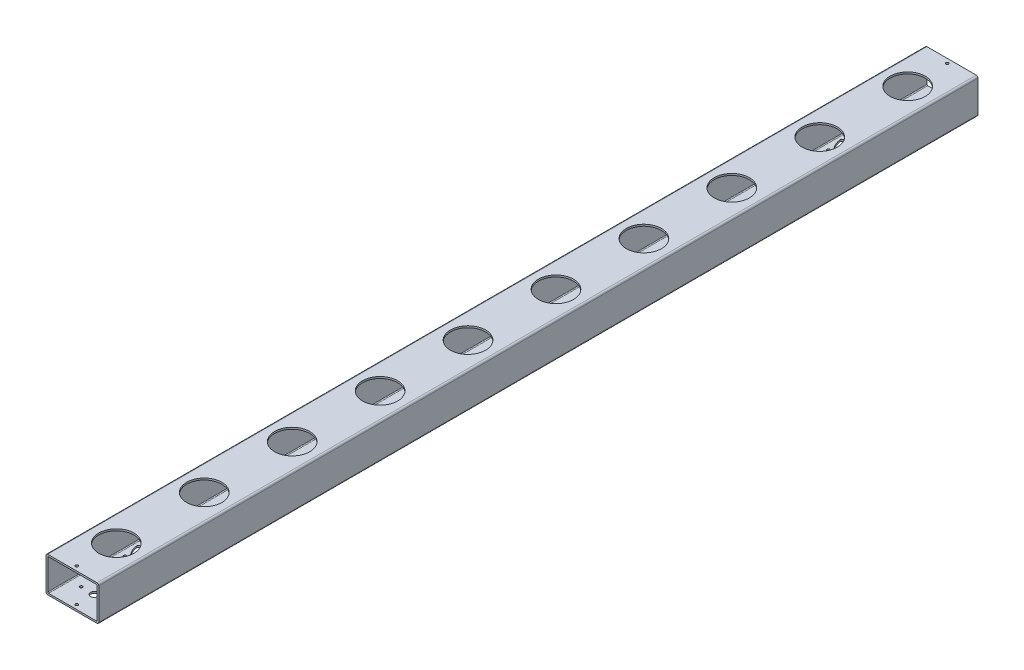
from build123d import *

# Parameters (mm, degrees)
ESQUISSE1_W                      = 60
ESQUISSE1_H                      = 40
ESQUISSE1_W_2                    = 56
ESQUISSE1_H_2                    = 36
BOSS_EXTRU_1_DEPTH               = 1000
CONG_1_R                         = 1
CONG_2_R                         = 2
ENL_V_MAT_EXTRU_1_REACH          = 1004.597
ESQUISSE2_R                      = 20
ENL_V_MAT_EXTRU_2_REACH          = 1004.597
ESQUISSE3_R                      = 4.25
ENL_V_MAT_EXTRU_4_REACH          = 1004.597
ESQUISSE6_R                      = 2.25
R_P_TITION_LIN_AIRE1_COUNT       = 3
R_P_TITION_LIN_AIRE1_PITCH       = 200
R_P_TITION_LIN_AIRE1_COL_COUNT   = 2
R_P_TITION_LIN_AIRE1_COL_PITCH   = 200
ENL_V_MAT_EXTRU_5_REACH          = 1004.597
ESQUISSE7_R                      = 1.6
ENL_V_MAT_EXTRU_6_REACH          = 1004.597
ESQUISSE9_R                      = 1.1
R_P_TITION_LIN_AIRE3_COUNT       = 10
R_P_TITION_LIN_AIRE3_PITCH       = 100
ENL_V_MAT_EXTRU_7_REACH          = 1004.597
ESQUISSE10_R                     = 1.75
R_P_TITION_LIN_AIRE4_COUNT       = 2
R_P_TITION_LIN_AIRE4_PITCH       = 800
ENL_V_MAT_EXTRU_8_REACH          = 1004.597
CONG_3_R                         = 2
R_P_TITION_LIN_AIRE5_COUNT       = 2
R_P_TITION_LIN_AIRE5_PITCH       = 800
CONG_3_OF_R_P_TITION_LIN_AIRE5_R = 2
ENL_V_MAT_EXTRU_9_REACH          = 1004.597
ESQUISSE12_R                     = 1.6
ENL_V_MAT_EXTRU_10_REACH         = 1004.597
ESQUISSE13_R                     = 1.9
ESQUISSE13_W                     = 26
ESQUISSE13_H                     = 14
ESQUISSE14_R                     = 1.6
ENL_V_MAT_EXTRU_11_DEPTH         = 1003.59662876
ENL_V_MAT_EXTRU_12_REACH         = 1004.597
ESQUISSE15_R                     = 2.5
ENL_V_MAT_EXTRU_13_REACH         = 1004.597
ESQUISSE16_R                     = 1.65
R_P_TITION_LIN_AIRE6_COUNT       = 10
R_P_TITION_LIN_AIRE6_PITCH       = 100


with BuildPart() as part:
    # Esquisse1 → Boss.-Extru.1 (new body)
    with BuildSketch(Plane.XY):
        with Locations((30, 20)):
            Rectangle(ESQUISSE1_W, ESQUISSE1_H)
        with Locations((30, 20)):
            Rectangle(ESQUISSE1_W_2, ESQUISSE1_H_2, mode=Mode.SUBTRACT)
    extrude(amount=BOSS_EXTRU_1_DEPTH)

    # Congé1
    cong_1_edges = [part.edges().sort_by_distance(p)[0] for p in [
        (2, 38, 500),
        (2, 2, 500),
        (58, 2, 500),
        (58, 38, 500),
    ]]
    fillet(cong_1_edges, radius=CONG_1_R)

    # Congé2
    cong_2_edges = [part.edges().sort_by_distance(p)[0] for p in [
        (0, 40, 500),
        (60, 40, 500),
        (60, 0, 500),
        (0, 0, 500),
    ]]
    fillet(cong_2_edges, radius=CONG_2_R)

    # Esquisse2 → Enlèv. mat.-Extru.1 (cut, up to next)
    with BuildSketch(Plane(origin=(0, 40, 0), x_dir=(1, 0, 0), z_dir=(0, 1, 0)), mode=Mode.PRIVATE) as enl_v_mat_extru_1_sk1:
        with Locations(Location((30, -50, 0), (0, 0, 270))):
            Circle(ESQUISSE2_R)
    enl_v_mat_extru_1_tool1 = extrude(enl_v_mat_extru_1_sk1.sketch, amount=-ENL_V_MAT_EXTRU_1_REACH, mode=Mode.PRIVATE) & part.part
    # Esquisse2 → Enlèv. mat.-Extru.1 (cut, up to next)
    with BuildSketch(Plane(origin=(0, 40, 0), x_dir=(1, 0, 0), z_dir=(0, 1, 0)), mode=Mode.PRIVATE) as enl_v_mat_extru_1_sk2:
        with Locations(Location((30, -150, 0), (0, 0, 270))):
            Circle(ESQUISSE2_R)
    enl_v_mat_extru_1_tool2 = extrude(enl_v_mat_extru_1_sk2.sketch, amount=-ENL_V_MAT_EXTRU_1_REACH, mode=Mode.PRIVATE) & part.part
    # Esquisse2 → Enlèv. mat.-Extru.1 (cut, up to next)
    with BuildSketch(Plane(origin=(0, 40, 0), x_dir=(1, 0, 0), z_dir=(0, 1, 0)), mode=Mode.PRIVATE) as enl_v_mat_extru_1_sk3:
        with Locations(Location((30, -250, 0), (0, 0, 270))):
            Circle(ESQUISSE2_R)
    enl_v_mat_extru_1_tool3 = extrude(enl_v_mat_extru_1_sk3.sketch, amount=-ENL_V_MAT_EXTRU_1_REACH, mode=Mode.PRIVATE) & part.part
    # Esquisse2 → Enlèv. mat.-Extru.1 (cut, up to next)
    with BuildSketch(Plane(origin=(0, 40, 0), x_dir=(1, 0, 0), z_dir=(0, 1, 0)), mode=Mode.PRIVATE) as enl_v_mat_extru_1_sk4:
        with Locations(Location((30, -350, 0), (0, 0, 270))):
            Circle(ESQUISSE2_R)
    enl_v_mat_extru_1_tool4 = extrude(enl_v_mat_extru_1_sk4.sketch, amount=-ENL_V_MAT_EXTRU_1_REACH, mode=Mode.PRIVATE) & part.part
    # Esquisse2 → Enlèv. mat.-Extru.1 (cut, up to next)
    with BuildSketch(Plane(origin=(0, 40, 0), x_dir=(1, 0, 0), z_dir=(0, 1, 0)), mode=Mode.PRIVATE) as enl_v_mat_extru_1_sk5:
        with Locations(Location((30, -450, 0), (0, 0, 270))):
            Circle(ESQUISSE2_R)
    enl_v_mat_extru_1_tool5 = extrude(enl_v_mat_extru_1_sk5.sketch, amount=-ENL_V_MAT_EXTRU_1_REACH, mode=Mode.PRIVATE) & part.part
    # Esquisse2 → Enlèv. mat.-Extru.1 (cut, up to next)
    with BuildSketch(Plane(origin=(0, 40, 0), x_dir=(1, 0, 0), z_dir=(0, 1, 0)), mode=Mode.PRIVATE) as enl_v_mat_extru_1_sk6:
        with Locations(Location((30, -550, 0), (0, 0, 270))):
            Circle(ESQUISSE2_R)
    enl_v_mat_extru_1_tool6 = extrude(enl_v_mat_extru_1_sk6.sketch, amount=-ENL_V_MAT_EXTRU_1_REACH, mode=Mode.PRIVATE) & part.part
    # Esquisse2 → Enlèv. mat.-Extru.1 (cut, up to next)
    with BuildSketch(Plane(origin=(0, 40, 0), x_dir=(1, 0, 0), z_dir=(0, 1, 0)), mode=Mode.PRIVATE) as enl_v_mat_extru_1_sk7:
        with Locations(Location((30, -650, 0), (0, 0, 270))):
            Circle(ESQUISSE2_R)
    enl_v_mat_extru_1_tool7 = extrude(enl_v_mat_extru_1_sk7.sketch, amount=-ENL_V_MAT_EXTRU_1_REACH, mode=Mode.PRIVATE) & part.part
    # Esquisse2 → Enlèv. mat.-Extru.1 (cut, up to next)
    with BuildSketch(Plane(origin=(0, 40, 0), x_dir=(1, 0, 0), z_dir=(0, 1, 0)), mode=Mode.PRIVATE) as enl_v_mat_extru_1_sk8:
        with Locations(Location((30, -750, 0), (0, 0, 270))):
            Circle(ESQUISSE2_R)
    enl_v_mat_extru_1_tool8 = extrude(enl_v_mat_extru_1_sk8.sketch, amount=-ENL_V_MAT_EXTRU_1_REACH, mode=Mode.PRIVATE) & part.part
    # Esquisse2 → Enlèv. mat.-Extru.1 (cut, up to next)
    with BuildSketch(Plane(origin=(0, 40, 0), x_dir=(1, 0, 0), z_dir=(0, 1, 0)), mode=Mode.PRIVATE) as enl_v_mat_extru_1_sk9:
        with Locations(Location((30, -850, 0), (0, 0, 270))):
            Circle(ESQUISSE2_R)
    enl_v_mat_extru_1_tool9 = extrude(enl_v_mat_extru_1_sk9.sketch, amount=-ENL_V_MAT_EXTRU_1_REACH, mode=Mode.PRIVATE) & part.part
    # Esquisse2 → Enlèv. mat.-Extru.1 (cut, up to next)
    with BuildSketch(Plane(origin=(0, 40, 0), x_dir=(1, 0, 0), z_dir=(0, 1, 0)), mode=Mode.PRIVATE) as enl_v_mat_extru_1_sk10:
        with Locations(Location((30, -950, 0), (0, 0, 270))):
            Circle(ESQUISSE2_R)
    enl_v_mat_extru_1_tool10 = extrude(enl_v_mat_extru_1_sk10.sketch, amount=-ENL_V_MAT_EXTRU_1_REACH, mode=Mode.PRIVATE) & part.part
    add(enl_v_mat_extru_1_tool1.solids().sort_by_distance((30, 40, 50))[0], mode=Mode.SUBTRACT)
    add(enl_v_mat_extru_1_tool2.solids().sort_by_distance((30, 40, 150))[0], mode=Mode.SUBTRACT)
    add(enl_v_mat_extru_1_tool3.solids().sort_by_distance((30, 40, 250))[0], mode=Mode.SUBTRACT)
    add(enl_v_mat_extru_1_tool4.solids().sort_by_distance((30, 40, 350))[0], mode=Mode.SUBTRACT)
    add(enl_v_mat_extru_1_tool5.solids().sort_by_distance((30, 40, 450))[0], mode=Mode.SUBTRACT)
    add(enl_v_mat_extru_1_tool6.solids().sort_by_distance((30, 40, 550))[0], mode=Mode.SUBTRACT)
    add(enl_v_mat_extru_1_tool7.solids().sort_by_distance((30, 40, 650))[0], mode=Mode.SUBTRACT)
    add(enl_v_mat_extru_1_tool8.solids().sort_by_distance((30, 40, 750))[0], mode=Mode.SUBTRACT)
    add(enl_v_mat_extru_1_tool9.solids().sort_by_distance((30, 40, 850))[0], mode=Mode.SUBTRACT)
    add(enl_v_mat_extru_1_tool10.solids().sort_by_distance((30, 40, 950))[0], mode=Mode.SUBTRACT)

    # Esquisse3 → Enlèv. mat.-Extru.2 (cut, up to next)
    with BuildSketch(Plane.XZ, mode=Mode.PRIVATE) as enl_v_mat_extru_2_sk1:
        with Locations(Location((30, 975, 0), (0, 0, 270))):
            Circle(ESQUISSE3_R)
    enl_v_mat_extru_2_tool1 = extrude(enl_v_mat_extru_2_sk1.sketch, amount=-ENL_V_MAT_EXTRU_2_REACH, mode=Mode.PRIVATE) & part.part
    # Esquisse3 → Enlèv. mat.-Extru.2 (cut, up to next)
    with BuildSketch(Plane.XZ, mode=Mode.PRIVATE) as enl_v_mat_extru_2_sk2:
        with Locations(Location((30, 25, 0), (0, 0, 270))):
            Circle(ESQUISSE3_R)
    enl_v_mat_extru_2_tool2 = extrude(enl_v_mat_extru_2_sk2.sketch, amount=-ENL_V_MAT_EXTRU_2_REACH, mode=Mode.PRIVATE) & part.part
    # Esquisse3 → Enlèv. mat.-Extru.2 (cut, up to next)
    with BuildSketch(Plane.XZ, mode=Mode.PRIVATE) as enl_v_mat_extru_2_sk3:
        with Locations(Location((30, 500, 0), (0, 0, 270))):
            Circle(ESQUISSE3_R)
    enl_v_mat_extru_2_tool3 = extrude(enl_v_mat_extru_2_sk3.sketch, amount=-ENL_V_MAT_EXTRU_2_REACH, mode=Mode.PRIVATE) & part.part
    add(enl_v_mat_extru_2_tool1.solids().sort_by_distance((30, 0, 975))[0], mode=Mode.SUBTRACT)
    add(enl_v_mat_extru_2_tool2.solids().sort_by_distance((30, 0, 25))[0], mode=Mode.SUBTRACT)
    add(enl_v_mat_extru_2_tool3.solids().sort_by_distance((30, 0, 500))[0], mode=Mode.SUBTRACT)

    # Esquisse6 → Enlèv. mat.-Extru.4 (cut, up to next)
    with BuildSketch(Plane(origin=(0, 0, 0), x_dir=(-1, 0, 0), z_dir=(0, -1, 0)), mode=Mode.PRIVATE) as enl_v_mat_extru_4_sk1:
        with Locations(Location((-20, -400, 0), (0, 0, 90))):
            Circle(ESQUISSE6_R)
    enl_v_mat_extru_4_tool1 = extrude(enl_v_mat_extru_4_sk1.sketch, amount=-ENL_V_MAT_EXTRU_4_REACH, mode=Mode.PRIVATE) & part.part
    # Esquisse6 → Enlèv. mat.-Extru.4 (cut, up to next)
    with BuildSketch(Plane(origin=(0, 0, 0), x_dir=(-1, 0, 0), z_dir=(0, -1, 0)), mode=Mode.PRIVATE) as enl_v_mat_extru_4_sk2:
        with Locations(Location((-40, -400, 0), (0, 0, 90))):
            Circle(ESQUISSE6_R)
    enl_v_mat_extru_4_tool2 = extrude(enl_v_mat_extru_4_sk2.sketch, amount=-ENL_V_MAT_EXTRU_4_REACH, mode=Mode.PRIVATE) & part.part
    enl_v_mat_extru_4_1 = enl_v_mat_extru_4_tool1.solids().sort_by_distance((20, 0, 400))[0]
    add(enl_v_mat_extru_4_1, mode=Mode.SUBTRACT)
    enl_v_mat_extru_4_2 = enl_v_mat_extru_4_tool2.solids().sort_by_distance((40, 0, 400))[0]
    add(enl_v_mat_extru_4_2, mode=Mode.SUBTRACT)
    enl_v_mat_extru_4 = enl_v_mat_extru_4_1 + enl_v_mat_extru_4_2  # Enlèv. mat.-Extru.4 as one shape, for the pattern or mirror that repeats it

    # Répétition linéaire1: Enlèv. mat.-Extru.4 ×3
    with Locations(*[(0, 0, i * R_P_TITION_LIN_AIRE1_PITCH) for i in range(1, R_P_TITION_LIN_AIRE1_COUNT)]):
        add(enl_v_mat_extru_4, mode=Mode.SUBTRACT)

    # Répétition linéaire1 col: Enlèv. mat.-Extru.4 ×2
    with Locations(*[(0, 0, -i * R_P_TITION_LIN_AIRE1_COL_PITCH) for i in range(1, R_P_TITION_LIN_AIRE1_COL_COUNT)]):
        add(enl_v_mat_extru_4, mode=Mode.SUBTRACT)

    # Esquisse7 → Enlèv. mat.-Extru.5 (cut, up to next)
    with BuildSketch(Plane(origin=(0, 0, 0), x_dir=(-1, 0, 0), z_dir=(0, -1, 0)), mode=Mode.PRIVATE) as enl_v_mat_extru_5_sk1:
        with Locations(Location((-15, -25, 0), (0, 0, 90))):
            Circle(ESQUISSE7_R)
    enl_v_mat_extru_5_tool1 = extrude(enl_v_mat_extru_5_sk1.sketch, amount=-ENL_V_MAT_EXTRU_5_REACH, mode=Mode.PRIVATE) & part.part
    # Esquisse7 → Enlèv. mat.-Extru.5 (cut, up to next)
    with BuildSketch(Plane(origin=(0, 0, 0), x_dir=(-1, 0, 0), z_dir=(0, -1, 0)), mode=Mode.PRIVATE) as enl_v_mat_extru_5_sk2:
        with Locations(Location((-45, -25, 0), (0, 0, 90))):
            Circle(ESQUISSE7_R)
    enl_v_mat_extru_5_tool2 = extrude(enl_v_mat_extru_5_sk2.sketch, amount=-ENL_V_MAT_EXTRU_5_REACH, mode=Mode.PRIVATE) & part.part
    # Esquisse7 → Enlèv. mat.-Extru.5 (cut, up to next)
    with BuildSketch(Plane(origin=(0, 0, 0), x_dir=(-1, 0, 0), z_dir=(0, -1, 0)), mode=Mode.PRIVATE) as enl_v_mat_extru_5_sk3:
        with Locations(Location((-15, -500, 0), (0, 0, 90))):
            Circle(ESQUISSE7_R)
    enl_v_mat_extru_5_tool3 = extrude(enl_v_mat_extru_5_sk3.sketch, amount=-ENL_V_MAT_EXTRU_5_REACH, mode=Mode.PRIVATE) & part.part
    # Esquisse7 → Enlèv. mat.-Extru.5 (cut, up to next)
    with BuildSketch(Plane(origin=(0, 0, 0), x_dir=(-1, 0, 0), z_dir=(0, -1, 0)), mode=Mode.PRIVATE) as enl_v_mat_extru_5_sk4:
        with Locations(Location((-45, -500, 0), (0, 0, 90))):
            Circle(ESQUISSE7_R)
    enl_v_mat_extru_5_tool4 = extrude(enl_v_mat_extru_5_sk4.sketch, amount=-ENL_V_MAT_EXTRU_5_REACH, mode=Mode.PRIVATE) & part.part
    # Esquisse7 → Enlèv. mat.-Extru.5 (cut, up to next)
    with BuildSketch(Plane(origin=(0, 0, 0), x_dir=(-1, 0, 0), z_dir=(0, -1, 0)), mode=Mode.PRIVATE) as enl_v_mat_extru_5_sk5:
        with Locations(Location((-15, -975, 0), (0, 0, 90))):
            Circle(ESQUISSE7_R)
    enl_v_mat_extru_5_tool5 = extrude(enl_v_mat_extru_5_sk5.sketch, amount=-ENL_V_MAT_EXTRU_5_REACH, mode=Mode.PRIVATE) & part.part
    # Esquisse7 → Enlèv. mat.-Extru.5 (cut, up to next)
    with BuildSketch(Plane(origin=(0, 0, 0), x_dir=(-1, 0, 0), z_dir=(0, -1, 0)), mode=Mode.PRIVATE) as enl_v_mat_extru_5_sk6:
        with Locations(Location((-45, -975, 0), (0, 0, 90))):
            Circle(ESQUISSE7_R)
    enl_v_mat_extru_5_tool6 = extrude(enl_v_mat_extru_5_sk6.sketch, amount=-ENL_V_MAT_EXTRU_5_REACH, mode=Mode.PRIVATE) & part.part
    add(enl_v_mat_extru_5_tool1.solids().sort_by_distance((15, 0, 25))[0], mode=Mode.SUBTRACT)
    add(enl_v_mat_extru_5_tool2.solids().sort_by_distance((45, 0, 25))[0], mode=Mode.SUBTRACT)
    add(enl_v_mat_extru_5_tool3.solids().sort_by_distance((15, 0, 500))[0], mode=Mode.SUBTRACT)
    add(enl_v_mat_extru_5_tool4.solids().sort_by_distance((45, 0, 500))[0], mode=Mode.SUBTRACT)
    add(enl_v_mat_extru_5_tool5.solids().sort_by_distance((15, 0, 975))[0], mode=Mode.SUBTRACT)
    add(enl_v_mat_extru_5_tool6.solids().sort_by_distance((45, 0, 975))[0], mode=Mode.SUBTRACT)

    # Esquisse9 → Enlèv. mat.-Extru.6 (cut, up to next)
    with BuildSketch(Plane.XZ, mode=Mode.PRIVATE) as enl_v_mat_extru_6_sk1:
        with Locations(Location((22, 955.18, 0), (0, 0, 270))):
            Circle(ESQUISSE9_R)
    enl_v_mat_extru_6_tool1 = extrude(enl_v_mat_extru_6_sk1.sketch, amount=-ENL_V_MAT_EXTRU_6_REACH, mode=Mode.PRIVATE) & part.part
    # Esquisse9 → Enlèv. mat.-Extru.6 (cut, up to next)
    with BuildSketch(Plane.XZ, mode=Mode.PRIVATE) as enl_v_mat_extru_6_sk2:
        with Locations(Location((38, 955.18, 0), (0, 0, 270))):
            Circle(ESQUISSE9_R)
    enl_v_mat_extru_6_tool2 = extrude(enl_v_mat_extru_6_sk2.sketch, amount=-ENL_V_MAT_EXTRU_6_REACH, mode=Mode.PRIVATE) & part.part
    enl_v_mat_extru_6_1 = enl_v_mat_extru_6_tool1.solids().sort_by_distance((22, 0, 955.18))[0]
    add(enl_v_mat_extru_6_1, mode=Mode.SUBTRACT)
    enl_v_mat_extru_6_2 = enl_v_mat_extru_6_tool2.solids().sort_by_distance((38, 0, 955.18))[0]
    add(enl_v_mat_extru_6_2, mode=Mode.SUBTRACT)
    enl_v_mat_extru_6 = enl_v_mat_extru_6_1 + enl_v_mat_extru_6_2  # Enlèv. mat.-Extru.6 as one shape, for the pattern or mirror that repeats it

    # Répétition linéaire3: Enlèv. mat.-Extru.6 ×10
    with Locations(*[(0, 0, -i * R_P_TITION_LIN_AIRE3_PITCH) for i in range(1, R_P_TITION_LIN_AIRE3_COUNT)]):
        add(enl_v_mat_extru_6, mode=Mode.SUBTRACT)

    # Esquisse10 → Enlèv. mat.-Extru.7 (cut, up to next)
    with BuildSketch(Plane.XZ, mode=Mode.PRIVATE) as enl_v_mat_extru_7_sk1:
        with Locations(Location((10, 120, 0), (0, 0, 270))):
            Circle(ESQUISSE10_R)
    enl_v_mat_extru_7_tool1 = extrude(enl_v_mat_extru_7_sk1.sketch, amount=-ENL_V_MAT_EXTRU_7_REACH, mode=Mode.PRIVATE) & part.part
    # Esquisse10 → Enlèv. mat.-Extru.7 (cut, up to next)
    with BuildSketch(Plane.XZ, mode=Mode.PRIVATE) as enl_v_mat_extru_7_sk2:
        with Locations(Location((50, 120, 0), (0, 0, 270))):
            Circle(ESQUISSE10_R)
    enl_v_mat_extru_7_tool2 = extrude(enl_v_mat_extru_7_sk2.sketch, amount=-ENL_V_MAT_EXTRU_7_REACH, mode=Mode.PRIVATE) & part.part
    # Esquisse10 → Enlèv. mat.-Extru.7 (cut, up to next)
    with BuildSketch(Plane.XZ, mode=Mode.PRIVATE) as enl_v_mat_extru_7_sk3:
        with Locations(Location((50, 80, 0), (0, 0, 270))):
            Circle(ESQUISSE10_R)
    enl_v_mat_extru_7_tool3 = extrude(enl_v_mat_extru_7_sk3.sketch, amount=-ENL_V_MAT_EXTRU_7_REACH, mode=Mode.PRIVATE) & part.part
    # Esquisse10 → Enlèv. mat.-Extru.7 (cut, up to next)
    with BuildSketch(Plane.XZ, mode=Mode.PRIVATE) as enl_v_mat_extru_7_sk4:
        with Locations(Location((10, 80, 0), (0, 0, 270))):
            Circle(ESQUISSE10_R)
    enl_v_mat_extru_7_tool4 = extrude(enl_v_mat_extru_7_sk4.sketch, amount=-ENL_V_MAT_EXTRU_7_REACH, mode=Mode.PRIVATE) & part.part
    enl_v_mat_extru_7_1 = enl_v_mat_extru_7_tool1.solids().sort_by_distance((10, 0, 120))[0]
    add(enl_v_mat_extru_7_1, mode=Mode.SUBTRACT)
    enl_v_mat_extru_7_2 = enl_v_mat_extru_7_tool2.solids().sort_by_distance((50, 0, 120))[0]
    add(enl_v_mat_extru_7_2, mode=Mode.SUBTRACT)
    enl_v_mat_extru_7_3 = enl_v_mat_extru_7_tool3.solids().sort_by_distance((50, 0, 80))[0]
    add(enl_v_mat_extru_7_3, mode=Mode.SUBTRACT)
    enl_v_mat_extru_7_4 = enl_v_mat_extru_7_tool4.solids().sort_by_distance((10, 0, 80))[0]
    add(enl_v_mat_extru_7_4, mode=Mode.SUBTRACT)
    enl_v_mat_extru_7 = enl_v_mat_extru_7_1 + enl_v_mat_extru_7_2 + enl_v_mat_extru_7_3 + enl_v_mat_extru_7_4  # Enlèv. mat.-Extru.7 as one shape, for the pattern or mirror that repeats it

    # Répétition linéaire4: Enlèv. mat.-Extru.7 ×2
    with Locations(*[(0, 0, i * R_P_TITION_LIN_AIRE4_PITCH) for i in range(1, R_P_TITION_LIN_AIRE4_COUNT)]):
        add(enl_v_mat_extru_7, mode=Mode.SUBTRACT)

    # Esquisse11 → Enlèv. mat.-Extru.8 (cut, up to next)
    with BuildSketch(Plane.XZ, mode=Mode.PRIVATE) as enl_v_mat_extru_8_sk1:
        with BuildLine():
            ThreePointArc((41.123553404, 921.266559657), (18, 920.784609691), (6.020842383, 901))
            Line((6.020842383, 901), (12.027799244, 901))
            ThreePointArc((12.027799244, 901), (21, 915.588457268), (38.120074974, 916.064382416))
            Line((38.120074974, 916.064382416), (41.123553404, 921.266559657))
        make_face()
    enl_v_mat_extru_8_tool1 = extrude(enl_v_mat_extru_8_sk1.sketch, amount=-ENL_V_MAT_EXTRU_8_REACH, mode=Mode.PRIVATE) & part.part
    # Esquisse11 → Enlèv. mat.-Extru.8 (cut, up to next)
    with BuildSketch(Plane.XZ, mode=Mode.PRIVATE) as enl_v_mat_extru_8_sk2:
        with BuildLine():
            ThreePointArc((38.120074974, 883.935617584), (21, 884.411542732), (12.027799244, 899))
            Line((12.027799244, 899), (6.020842383, 899))
            ThreePointArc((6.020842383, 899), (18, 879.215390309), (41.123553404, 878.733440343))
            Line((41.123553404, 878.733440343), (38.120074974, 883.935617584))
        make_face()
    enl_v_mat_extru_8_tool2 = extrude(enl_v_mat_extru_8_sk2.sketch, amount=-ENL_V_MAT_EXTRU_8_REACH, mode=Mode.PRIVATE) & part.part
    # Esquisse11 → Enlèv. mat.-Extru.8 (cut, up to next)
    with BuildSketch(Plane.XZ, mode=Mode.PRIVATE) as enl_v_mat_extru_8_sk3:
        with BuildLine():
            Line((39.852125782, 884.935617584), (42.855604212, 879.733440343))
            ThreePointArc((42.855604212, 879.733440343), (54, 900), (42.855604212, 920.266559657))
            Line((42.855604212, 920.266559657), (39.852125782, 915.064382416))
            ThreePointArc((39.852125782, 915.064382416), (48, 900), (39.852125782, 884.935617584))
        make_face()
    enl_v_mat_extru_8_tool3 = extrude(enl_v_mat_extru_8_sk3.sketch, amount=-ENL_V_MAT_EXTRU_8_REACH, mode=Mode.PRIVATE) & part.part
    # Esquisse11 → Enlèv. mat.-Extru.8 (cut, up to next)
    with BuildSketch(Plane.XZ, mode=Mode.PRIVATE) as enl_v_mat_extru_8_sk4:
        with BuildLine():
            Line((20.050125629, 899), (14.031280577, 899))
            ThreePointArc((14.031280577, 899), (22, 886.143593539), (37.118334308, 885.670683314))
            Line((37.118334308, 885.670683314), (34.108911782, 890.88315603))
            ThreePointArc((34.108911782, 890.88315603), (25, 891.339745962), (20.050125629, 899))
        make_face()
    enl_v_mat_extru_8_tool4 = extrude(enl_v_mat_extru_8_sk4.sketch, amount=-ENL_V_MAT_EXTRU_8_REACH, mode=Mode.PRIVATE) & part.part
    # Esquisse11 → Enlèv. mat.-Extru.8 (cut, up to next)
    with BuildSketch(Plane.XZ, mode=Mode.PRIVATE) as enl_v_mat_extru_8_sk5:
        with BuildLine():
            ThreePointArc((35.840962589, 891.88315603), (40, 900), (35.840962589, 908.11684397))
            Line((35.840962589, 908.11684397), (38.850385115, 913.329316686))
            ThreePointArc((38.850385115, 913.329316686), (46, 900), (38.850385115, 886.670683314))
            Line((38.850385115, 886.670683314), (35.840962589, 891.88315603))
        make_face()
    enl_v_mat_extru_8_tool5 = extrude(enl_v_mat_extru_8_sk5.sketch, amount=-ENL_V_MAT_EXTRU_8_REACH, mode=Mode.PRIVATE) & part.part
    # Esquisse11 → Enlèv. mat.-Extru.8 (cut, up to next)
    with BuildSketch(Plane.XZ, mode=Mode.PRIVATE) as enl_v_mat_extru_8_sk6:
        with BuildLine():
            ThreePointArc((34.108911782, 909.11684397), (25, 908.660254038), (20.050125629, 901))
            Line((20.050125629, 901), (14.031280577, 901))
            ThreePointArc((14.031280577, 901), (22, 913.856406461), (37.118334308, 914.329316686))
            Line((37.118334308, 914.329316686), (34.108911782, 909.11684397))
        make_face()
    enl_v_mat_extru_8_tool6 = extrude(enl_v_mat_extru_8_sk6.sketch, amount=-ENL_V_MAT_EXTRU_8_REACH, mode=Mode.PRIVATE) & part.part
    enl_v_mat_extru_8_1 = enl_v_mat_extru_8_tool1.solids().sort_by_distance((20.790167, 0, 915.951899))[0]
    add(enl_v_mat_extru_8_1, mode=Mode.SUBTRACT)
    enl_v_mat_extru_8_2 = enl_v_mat_extru_8_tool2.solids().sort_by_distance((39.258372, 0, 881.124696))[0]
    add(enl_v_mat_extru_8_2, mode=Mode.SUBTRACT)
    enl_v_mat_extru_8_3 = enl_v_mat_extru_8_tool3.solids().sort_by_distance((53.570687, 0, 900))[0]
    add(enl_v_mat_extru_8_3, mode=Mode.SUBTRACT)
    enl_v_mat_extru_8_4 = enl_v_mat_extru_8_tool4.solids().sort_by_distance((24.369775, 0, 890.248165))[0]
    add(enl_v_mat_extru_8_4, mode=Mode.SUBTRACT)
    enl_v_mat_extru_8_5 = enl_v_mat_extru_8_tool5.solids().sort_by_distance((41.260449, 0, 900))[0]
    add(enl_v_mat_extru_8_5, mode=Mode.SUBTRACT)
    enl_v_mat_extru_8_6 = enl_v_mat_extru_8_tool6.solids().sort_by_distance((24.369775, 0, 909.751835))[0]
    add(enl_v_mat_extru_8_6, mode=Mode.SUBTRACT)
    enl_v_mat_extru_8 = enl_v_mat_extru_8_1 + enl_v_mat_extru_8_2 + enl_v_mat_extru_8_3 + enl_v_mat_extru_8_4 + enl_v_mat_extru_8_5 + enl_v_mat_extru_8_6  # Enlèv. mat.-Extru.8 as one shape, for the pattern or mirror that repeats it

    # Congé3
    cong_3_edges = [part.edges().sort_by_distance(p)[0] for p in [
        (14.031280577, 1, 899),
        (20.050125629, 1, 899),
        (34.108911782, 1, 890.88315603),
        (37.118334308, 1, 885.670683314),
        (35.840962589, 1, 891.88315603),
        (35.840962589, 1, 908.11684397),
        (38.850385115, 1, 913.329316686),
        (38.850385115, 1, 886.670683314),
        (12.027799244, 1, 899),
        (38.120074974, 1, 883.935617584),
        (41.123553404, 1, 878.733440343),
        (6.020842383, 1, 899),
        (39.852125782, 1, 884.935617584),
        (39.852125782, 1, 915.064382416),
        (42.855604212, 1, 920.266559657),
        (42.855604212, 1, 879.733440343),
        (34.108911782, 1, 909.11684397),
        (20.050125629, 1, 901),
        (14.031280577, 1, 901),
        (37.118334308, 1, 914.329316686),
        (38.120074974, 1, 916.064382416),
        (12.027799244, 1, 901),
        (6.020842383, 1, 901),
        (41.123553404, 1, 921.266559657),
    ]]
    fillet(cong_3_edges, radius=CONG_3_R)

    # Répétition linéaire5: Enlèv. mat.-Extru.8 ×2
    with Locations(*[(0, 0, -i * R_P_TITION_LIN_AIRE5_PITCH) for i in range(1, R_P_TITION_LIN_AIRE5_COUNT)]):
        add(enl_v_mat_extru_8, mode=Mode.SUBTRACT)

    # Congé3 of Répétition linéaire5
    cong_3_of_r_p_tition_lin_aire5_edges = [part.edges().sort_by_distance(p)[0] for p in [
        (14.031280577, 1, 99),
        (20.050125629, 1, 99),
        (34.108911782, 1, 90.88315603),
        (37.118334308, 1, 85.670683314),
        (35.840962589, 1, 91.88315603),
        (35.840962589, 1, 108.11684397),
        (38.850385115, 1, 113.329316686),
        (38.850385115, 1, 86.670683314),
        (12.027799244, 1, 99),
        (38.120074974, 1, 83.935617584),
        (41.123553404, 1, 78.733440343),
        (6.020842383, 1, 99),
        (39.852125782, 1, 84.935617584),
        (39.852125782, 1, 115.064382416),
        (42.855604212, 1, 120.266559657),
        (42.855604212, 1, 79.733440343),
        (34.108911782, 1, 109.11684397),
        (20.050125629, 1, 101),
        (14.031280577, 1, 101),
        (37.118334308, 1, 114.329316686),
        (38.120074974, 1, 116.064382416),
        (12.027799244, 1, 101),
        (6.020842383, 1, 101),
        (41.123553404, 1, 121.266559657),
    ]]
    fillet(cong_3_of_r_p_tition_lin_aire5_edges, radius=CONG_3_OF_R_P_TITION_LIN_AIRE5_R)

    # Esquisse12 → Enlèv. mat.-Extru.9 (cut, up to next)
    with BuildSketch(Plane.XZ, mode=Mode.PRIVATE) as enl_v_mat_extru_9_sk1:
        with Locations(Location((10, 740.18, 0), (0, 0, 270))):
            Circle(ESQUISSE12_R)
    enl_v_mat_extru_9_tool1 = extrude(enl_v_mat_extru_9_sk1.sketch, amount=-ENL_V_MAT_EXTRU_9_REACH, mode=Mode.PRIVATE) & part.part
    # Esquisse12 → Enlèv. mat.-Extru.9 (cut, up to next)
    with BuildSketch(Plane.XZ, mode=Mode.PRIVATE) as enl_v_mat_extru_9_sk2:
        with Locations(Location((50, 740.18, 0), (0, 0, 270))):
            Circle(ESQUISSE12_R)
    enl_v_mat_extru_9_tool2 = extrude(enl_v_mat_extru_9_sk2.sketch, amount=-ENL_V_MAT_EXTRU_9_REACH, mode=Mode.PRIVATE) & part.part
    # Esquisse12 → Enlèv. mat.-Extru.9 (cut, up to next)
    with BuildSketch(Plane.XZ, mode=Mode.PRIVATE) as enl_v_mat_extru_9_sk3:
        with Locations(Location((50, 670.18, 0), (0, 0, 270))):
            Circle(ESQUISSE12_R)
    enl_v_mat_extru_9_tool3 = extrude(enl_v_mat_extru_9_sk3.sketch, amount=-ENL_V_MAT_EXTRU_9_REACH, mode=Mode.PRIVATE) & part.part
    # Esquisse12 → Enlèv. mat.-Extru.9 (cut, up to next)
    with BuildSketch(Plane.XZ, mode=Mode.PRIVATE) as enl_v_mat_extru_9_sk4:
        with Locations(Location((10, 670.18, 0), (0, 0, 270))):
            Circle(ESQUISSE12_R)
    enl_v_mat_extru_9_tool4 = extrude(enl_v_mat_extru_9_sk4.sketch, amount=-ENL_V_MAT_EXTRU_9_REACH, mode=Mode.PRIVATE) & part.part
    add(enl_v_mat_extru_9_tool1.solids().sort_by_distance((10, 0, 740.18))[0], mode=Mode.SUBTRACT)
    add(enl_v_mat_extru_9_tool2.solids().sort_by_distance((50, 0, 740.18))[0], mode=Mode.SUBTRACT)
    add(enl_v_mat_extru_9_tool3.solids().sort_by_distance((50, 0, 670.18))[0], mode=Mode.SUBTRACT)
    add(enl_v_mat_extru_9_tool4.solids().sort_by_distance((10, 0, 670.18))[0], mode=Mode.SUBTRACT)

    # Esquisse13 → Enlèv. mat.-Extru.10 (cut, up to next)
    with BuildSketch(Plane.XZ, mode=Mode.PRIVATE) as enl_v_mat_extru_10_sk1:
        with Locations(Location((17, 705.18, 0), (0, 0, 270))):
            Circle(ESQUISSE13_R)
    enl_v_mat_extru_10_tool1 = extrude(enl_v_mat_extru_10_sk1.sketch, amount=-ENL_V_MAT_EXTRU_10_REACH, mode=Mode.PRIVATE) & part.part
    # Esquisse13 → Enlèv. mat.-Extru.10 (cut, up to next)
    with BuildSketch(Plane.XZ, mode=Mode.PRIVATE) as enl_v_mat_extru_10_sk2:
        with Locations(Location((30, 705.18, 0), (0, 0, 270))):
            Circle(ESQUISSE13_R)
    enl_v_mat_extru_10_tool2 = extrude(enl_v_mat_extru_10_sk2.sketch, amount=-ENL_V_MAT_EXTRU_10_REACH, mode=Mode.PRIVATE) & part.part
    # Esquisse13 → Enlèv. mat.-Extru.10 (cut, up to next)
    with BuildSketch(Plane.XZ, mode=Mode.PRIVATE) as enl_v_mat_extru_10_sk3:
        with Locations(Location((43, 705.18, 0), (0, 0, 270))):
            Circle(ESQUISSE13_R)
    enl_v_mat_extru_10_tool3 = extrude(enl_v_mat_extru_10_sk3.sketch, amount=-ENL_V_MAT_EXTRU_10_REACH, mode=Mode.PRIVATE) & part.part
    # Esquisse13 → Enlèv. mat.-Extru.10 (cut, up to next)
    with BuildSketch(Plane.XZ, mode=Mode.PRIVATE) as enl_v_mat_extru_10_sk4:
        with Locations((30, 722.18)):
            Rectangle(ESQUISSE13_W, ESQUISSE13_H)
    enl_v_mat_extru_10_tool4 = extrude(enl_v_mat_extru_10_sk4.sketch, amount=-ENL_V_MAT_EXTRU_10_REACH, mode=Mode.PRIVATE) & part.part
    add(enl_v_mat_extru_10_tool1.solids().sort_by_distance((17, 0, 705.18))[0], mode=Mode.SUBTRACT)
    add(enl_v_mat_extru_10_tool2.solids().sort_by_distance((30, 0, 705.18))[0], mode=Mode.SUBTRACT)
    add(enl_v_mat_extru_10_tool3.solids().sort_by_distance((43, 0, 705.18))[0], mode=Mode.SUBTRACT)
    add(enl_v_mat_extru_10_tool4.solids().sort_by_distance((30, 0, 722.18))[0], mode=Mode.SUBTRACT)

    # Esquisse14 → Enlèv. mat.-Extru.11 (cut, through all)
    with BuildSketch(Plane.XZ):
        with Locations(Location((30, 5, 0), (0, 0, 270))):
            Circle(ESQUISSE14_R)
        with Locations(Location((30, 995, 0), (0, 0, 270))):
            Circle(ESQUISSE14_R)
    extrude(amount=-ENL_V_MAT_EXTRU_11_DEPTH, mode=Mode.SUBTRACT)

    # Esquisse15 → Enlèv. mat.-Extru.12 (cut, up to next)
    with BuildSketch(Plane.XZ, mode=Mode.PRIVATE) as enl_v_mat_extru_12_sk1:
        with Locations(Location((30, 425, 0), (0, 0, 270))):
            Circle(ESQUISSE15_R)
    enl_v_mat_extru_12_tool1 = extrude(enl_v_mat_extru_12_sk1.sketch, amount=-ENL_V_MAT_EXTRU_12_REACH, mode=Mode.PRIVATE) & part.part
    add(enl_v_mat_extru_12_tool1.solids().sort_by_distance((30, 0, 425))[0], mode=Mode.SUBTRACT)

    # Esquisse16 → Enlèv. mat.-Extru.13 (cut, up to next)
    with BuildSketch(Plane.XZ, mode=Mode.PRIVATE) as enl_v_mat_extru_13_sk1:
        with Locations(Location((30, 962.7, 0), (0, 0, 270))):
            Circle(ESQUISSE16_R)
    enl_v_mat_extru_13_tool1 = extrude(enl_v_mat_extru_13_sk1.sketch, amount=-ENL_V_MAT_EXTRU_13_REACH, mode=Mode.PRIVATE) & part.part
    # Esquisse16 → Enlèv. mat.-Extru.13 (cut, up to next)
    with BuildSketch(Plane.XZ, mode=Mode.PRIVATE) as enl_v_mat_extru_13_sk2:
        with Locations(Location((30, 937.3, 0), (0, 0, 270))):
            Circle(ESQUISSE16_R)
    enl_v_mat_extru_13_tool2 = extrude(enl_v_mat_extru_13_sk2.sketch, amount=-ENL_V_MAT_EXTRU_13_REACH, mode=Mode.PRIVATE) & part.part
    enl_v_mat_extru_13_1 = enl_v_mat_extru_13_tool1.solids().sort_by_distance((30, 0, 962.7))[0]
    add(enl_v_mat_extru_13_1, mode=Mode.SUBTRACT)
    enl_v_mat_extru_13_2 = enl_v_mat_extru_13_tool2.solids().sort_by_distance((30, 0, 937.3))[0]
    add(enl_v_mat_extru_13_2, mode=Mode.SUBTRACT)
    enl_v_mat_extru_13 = enl_v_mat_extru_13_1 + enl_v_mat_extru_13_2  # Enlèv. mat.-Extru.13 as one shape, for the pattern or mirror that repeats it

    # Répétition linéaire6: Enlèv. mat.-Extru.13 ×10
    with Locations(*[(0, 0, -i * R_P_TITION_LIN_AIRE6_PITCH) for i in range(1, R_P_TITION_LIN_AIRE6_COUNT)]):
        add(enl_v_mat_extru_13, mode=Mode.SUBTRACT)


solid = part.part
